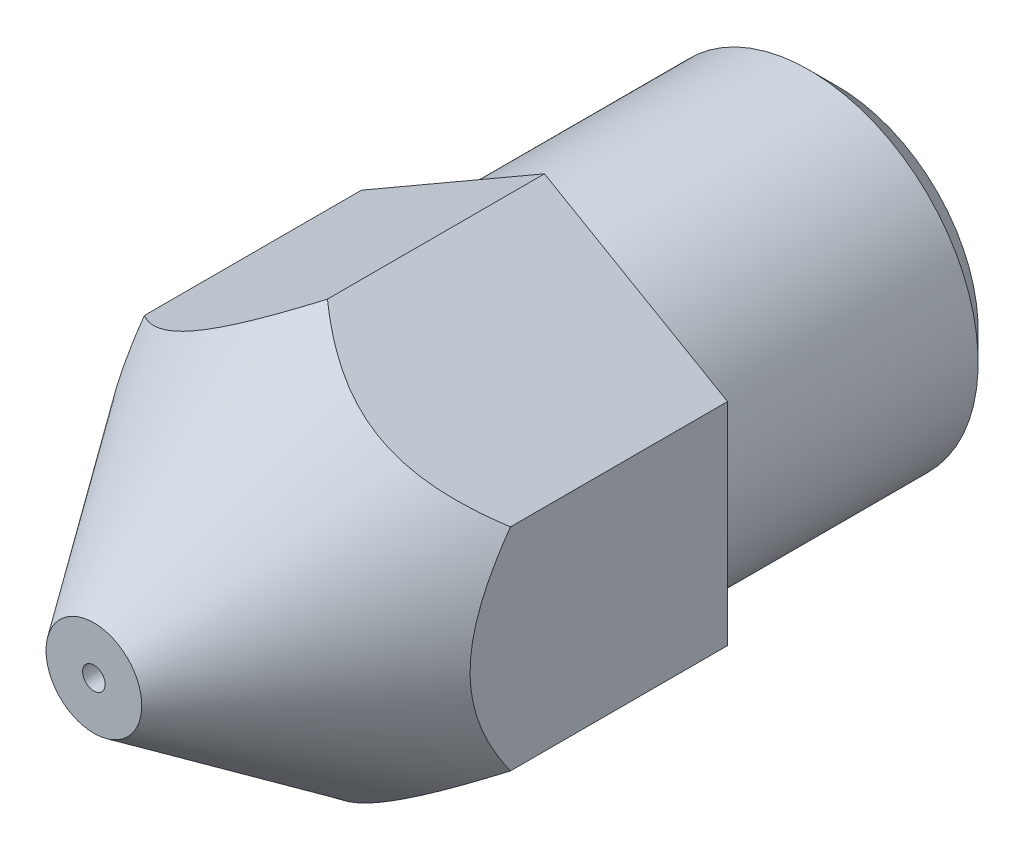
from build123d import *

# Parameters (mm, degrees)
SKETCH2_OUTSIDE_W  = 13.478
SKETCH2_OUTSIDE_H  = 13.478
CUT_EXTRUDE2_DEPTH = 10
CHAMFER1_SIZE      = 0.5
SKETCH3_R          = 0.2
CUT_EXTRUDE3_DEPTH = 15.102688869


with BuildPart() as part:
    # Sketch1 → Revolve1 (revolve)
    with BuildSketch(Plane(origin=(0, 0, 0), x_dir=(1, 0, 0), z_dir=(0, 1, 0)), mode=Mode.PRIVATE) as revolve1_sk:
        Polygon((1, 8.7), (3, 8.7), (3, 3.5), (4, 3.5), (4, 0), (0.85, -4.5), (0, -4.5), (0, -3.673205081), (1, -1.941154273), align=None)
    revolve(revolve1_sk.sketch.rotate(Axis((0, 0, 0), (0, 0, 1)), 180), axis=Axis((0, 0, 0), (0, 0, 1)))

    # Sketch2 outside → Cut-Extrude2 (cut)
    with BuildSketch(Plane(origin=(0, 0, -3.5), x_dir=(-1, 0, 0), z_dir=(0, 0, -1))):
        Rectangle(SKETCH2_OUTSIDE_W, SKETCH2_OUTSIDE_H)
        Polygon((3.25, 1.876388375), (0, 3.75277675), (-3.25, 1.876388375), (-3.25, -1.876388375), (0, -3.75277675), (3.25, -1.876388375), align=None, mode=Mode.SUBTRACT)
    extrude(amount=-CUT_EXTRUDE2_DEPTH, mode=Mode.SUBTRACT)

    # Chamfer1
    chamfer1_edges = [part.edges().sort_by_distance(p)[0] for p in [
        (3, 0, -8.7),
    ]]
    chamfer(chamfer1_edges, length=CHAMFER1_SIZE)

    # Sketch3 → Cut-Extrude3 (cut, through all)
    with BuildSketch(Plane.XY.offset(4.5)):
        Circle(SKETCH3_R)
    extrude(amount=-CUT_EXTRUDE3_DEPTH, mode=Mode.SUBTRACT)


solid = part.part
